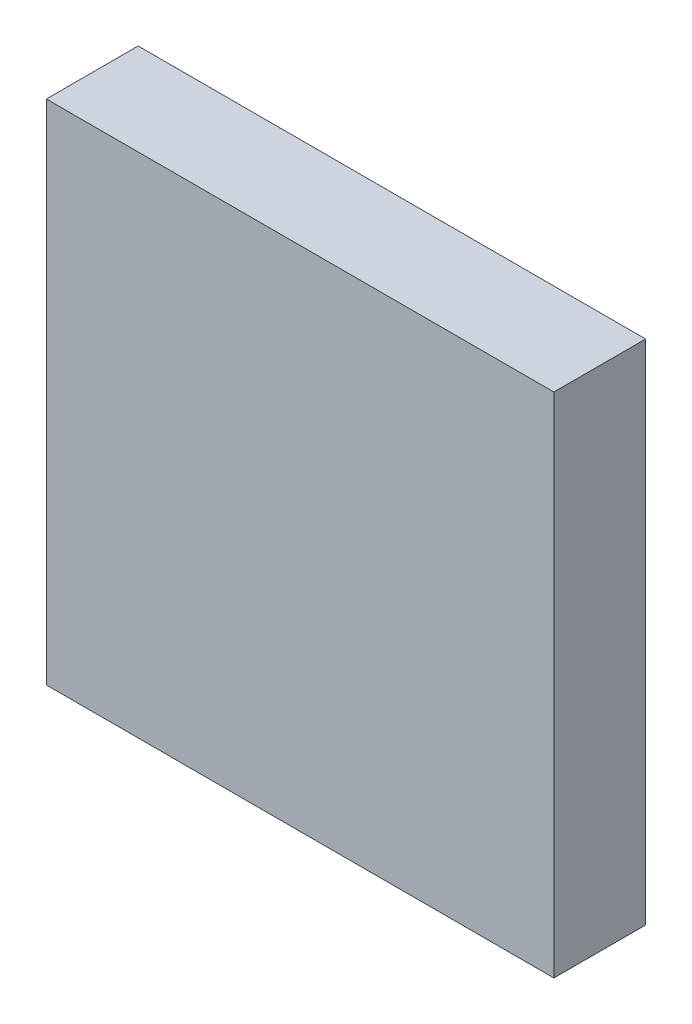
from build123d import *

# Parameters (mm, degrees)
ESQUISSE1_W             = 5.5302
ESQUISSE1_H             = 5.5302
COMPONENT_OUTLINE_DEPTH = 1


with BuildPart() as part:
    # Esquisse1 → Component_Outline (new body)
    with BuildSketch(Plane.XY):
        with Locations((-0.1381, 0.1381)):
            Rectangle(ESQUISSE1_W, ESQUISSE1_H)
    extrude(amount=COMPONENT_OUTLINE_DEPTH)


solid = part.part
